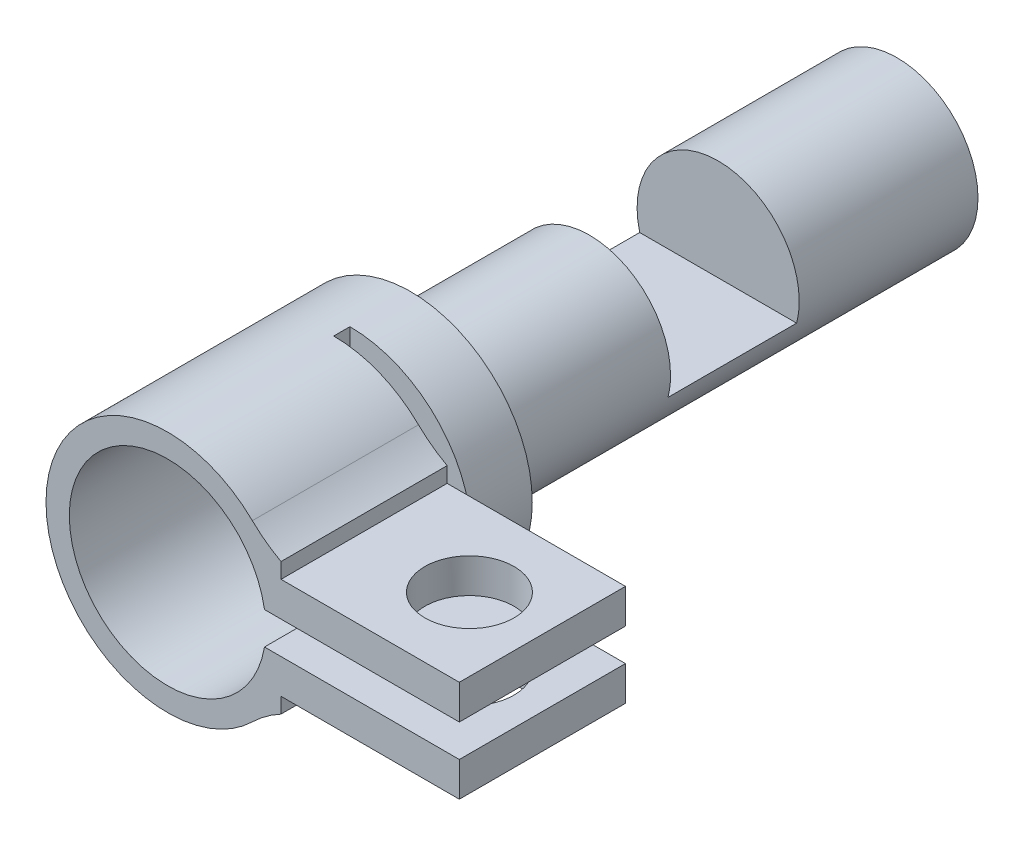
from build123d import *

# Parameters (mm, degrees)
BOSS_EXTRUDE3_DEPTH     = 1.25
SKETCH6_W               = 7.2
SKETCH6_H               = 4.5
CUT_EXTRUDE1_DEPTH      = 0.4
CUT_EXTRUDE2_START      = -4.5
SKETCH7_W               = 8
SKETCH7_H               = 10
CUT_EXTRUDE2_DEPTH      = 0.4
M2_CLEARANCE_HOLE1_D    = 2.2
CUT_EXTRUDE3_DEPTH      = 20.617339269
CUT_EXTRUDE3_DEPTH_BACK = 0.5
SKETCH10_W              = 10
SKETCH10_H              = 3.175
FILLET1_R               = 3.175
CUT_EXTRUDE4_REACH      = 21.847
CUT_EXTRUDE4_END_RADIUS = 3.175
SKETCH12_W              = 4.4
SKETCH12_H              = 4.1


with BuildPart() as part:
    # Sketch3 → Revolve1 (revolve)
    with BuildSketch(Plane(origin=(0, 0, 0), x_dir=(0, 0, -1), z_dir=(1, 0, 0)), mode=Mode.PRIVATE) as revolve1_sk:
        Polygon((18, 0), (18, 2), (6, 2), (6, 3), (0, 3), (0, 2.425), (4.5, 2.425), (4.5, 0), align=None)
    revolve(revolve1_sk.sketch.rotate(Axis((0, 0, 12.785862786), (0, 0, -1)), 90), axis=Axis((0, 0, 12.785862786), (0, 0, -1)))

    # Sketch5 → Boss-Extrude3 (add, symmetric)
    with BuildSketch(Plane(origin=(0, 0, 0), x_dir=(1, 0, 0), z_dir=(0, 1, 0))):
        Polygon((3, 4.5), (7.2, 4.5), (7.2, 0), (3, 0), (2.425, 0), (2.425, 4.5), align=None)
    extrude(amount=BOSS_EXTRUDE3_DEPTH, both=True)

    # Sketch6 → Cut-Extrude1 (cut, symmetric)
    with BuildSketch(Plane(origin=(0, 0, 0), x_dir=(1, 0, 0), z_dir=(0, 1, 0))):
        with Locations((3.6, 2.25)):
            Rectangle(SKETCH6_W, SKETCH6_H)
    extrude(amount=CUT_EXTRUDE1_DEPTH, both=True, mode=Mode.SUBTRACT)

    # Sketch7 → Cut-Extrude2 (cut)
    with BuildSketch(Plane.XY.offset(CUT_EXTRUDE2_START)):
        with Locations((4, 0)):
            Rectangle(SKETCH7_W, SKETCH7_H)
    extrude(amount=CUT_EXTRUDE2_DEPTH, mode=Mode.SUBTRACT)

    # M2 Clearance Hole1 (through all)
    with Locations(Plane(origin=(0, 1.25, 0), x_dir=(1, 0, 0), z_dir=(0, 1, 0))):
        with Locations((5.4, 2.05)):
            Hole(M2_CLEARANCE_HOLE1_D / 2)

    # Sketch10 → Cut-Extrude3 (cut, two sides: drawn at the far end of the back side and taken through both)
    with BuildSketch(Plane(origin=(0, 0, 0), x_dir=(1, 0, 0), z_dir=(0, 1, 0)).offset(-CUT_EXTRUDE3_DEPTH_BACK)):
        with Locations((0, 12)):
            Rectangle(SKETCH10_W, SKETCH10_H)
    extrude(amount=CUT_EXTRUDE3_DEPTH + CUT_EXTRUDE3_DEPTH_BACK, mode=Mode.SUBTRACT)

    # Fillet1
    fillet1_edges = [part.edges().sort_by_distance(p)[0] for p in [
        (2.727178029, -1.25, -2.05),
        (2.727178029, 1.25, -2.05),
    ]]
    fillet(fillet1_edges, radius=FILLET1_R)

    # Cut-Extrude4: up to this cylinder (the profile starts outside it)
    cut_extrude4_end = Plane(origin=(4.306971093, 4.425, -2.05), z_dir=(0, 0, 1)) * Cylinder(CUT_EXTRUDE4_END_RADIUS, 51.044, mode=Mode.PRIVATE)
    # Sketch12 → Cut-Extrude4 (cut, up to the surface)
    with BuildSketch(Plane(origin=(0, 1.25, 0), x_dir=(1, 0, 0), z_dir=(0, 1, 0)), mode=Mode.PRIVATE) as cut_extrude4_sk1:
        with Locations((5, 2.05)):
            Rectangle(SKETCH12_W, SKETCH12_H)
    cut_extrude4_tool1 = extrude(cut_extrude4_sk1.sketch, amount=CUT_EXTRUDE4_REACH, mode=Mode.PRIVATE) - cut_extrude4_end
    cut_extrude4 = cut_extrude4_tool1.solids().sort_by_distance((5, 1.25, -2.05))[0] + cut_extrude4_tool1.solids().sort_by_distance((5, 1.25, -2.05))[1]
    add(cut_extrude4, mode=Mode.SUBTRACT)

    # Mirror1: Cut-Extrude4 across plane
    add(cut_extrude4.mirror(Plane.ZX), mode=Mode.SUBTRACT)


solid = part.part
